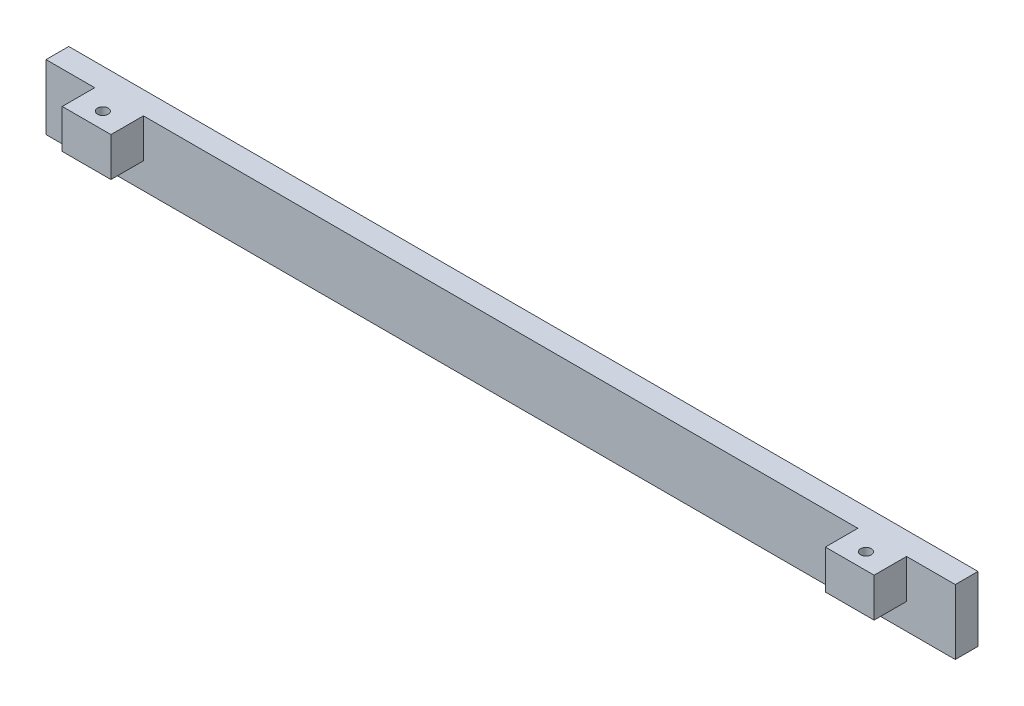
from build123d import *

# Parameters (mm, degrees)
SKETCH_1_W         = 7
SKETCH_1_H         = 20
EXTRUDE_1_DEPTH    = 140
SKETCH_2_W         = 15
SKETCH_2_H         = 12
EXTRUDE_2_DEPTH    = 10
HOLE_WIZARD_M4_1_D = 3.3


with BuildPart() as part:
    # 草图1 → 凸台-拉伸1 (new, symmetric)
    with BuildSketch(Plane(origin=(0, 0, 0), x_dir=(0, 0, -1), z_dir=(1, 0, 0))):
        Rectangle(SKETCH_1_W, SKETCH_1_H)
    extrude(amount=EXTRUDE_1_DEPTH, both=True)

    # 草图2 → 凸台-拉伸2 (add)
    with BuildSketch(Plane.XY.offset(3.5)):
        with Locations((-117.5, 4)):
            Rectangle(SKETCH_2_W, SKETCH_2_H)
    extrude_2 = extrude(amount=EXTRUDE_2_DEPTH)

    # 镜向1: 凸台-拉伸2 across plane
    add(extrude_2.mirror(Plane(origin=(0, 0, 0), x_dir=(0, 0, 1), z_dir=(1, 0, 0))))

    # M4 螺纹孔1 (through all)
    with Locations(Plane(origin=(0, -2, 0), x_dir=(-1, 0, 0), z_dir=(0, -1, 0))):
        with Locations((-117.5, -8.5), (117.5, -8.5)):
            Hole(HOLE_WIZARD_M4_1_D / 2)


solid = part.part
